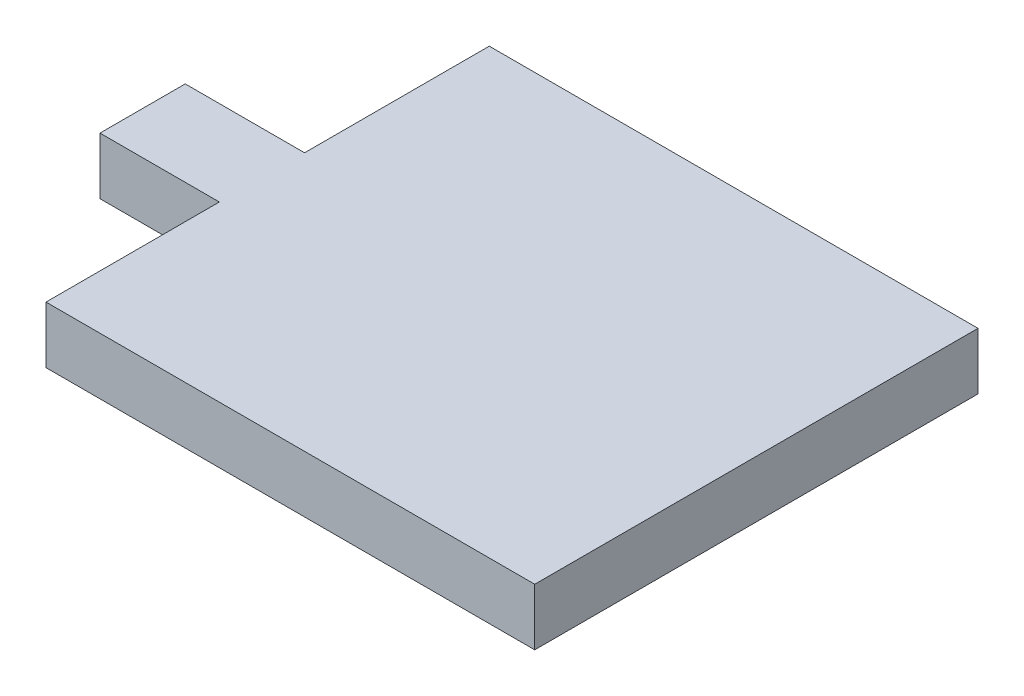
from build123d import *

# Parameters (mm, degrees)
BOSS_EXTRUDE1_DEPTH = 5
SKETCH3_W           = 5
SKETCH3_H           = 2
CUT_EXTRUDE1_DEPTH  = 14


with BuildPart() as part:
    # Sketch1 → Boss-Extrude1 (new body)
    with BuildSketch(Plane(origin=(0, 0, 0), x_dir=(1, 0, 0), z_dir=(0, 1, 0))):
        Polygon((0, 22.75), (-10.5, 22.75), (-10.5, 15.25), (0, 15.25), (0, 0), (43, 0), (43, 39), (0, 39), align=None)
    extrude(amount=BOSS_EXTRUDE1_DEPTH)

    # Sketch3 → Cut-Extrude1 (cut)
    with BuildSketch(Plane.ZY.offset(10.5)):
        with Locations((-19, 2.5)):
            Rectangle(SKETCH3_W, SKETCH3_H)
    extrude(amount=-CUT_EXTRUDE1_DEPTH, mode=Mode.SUBTRACT)


solid = part.part
